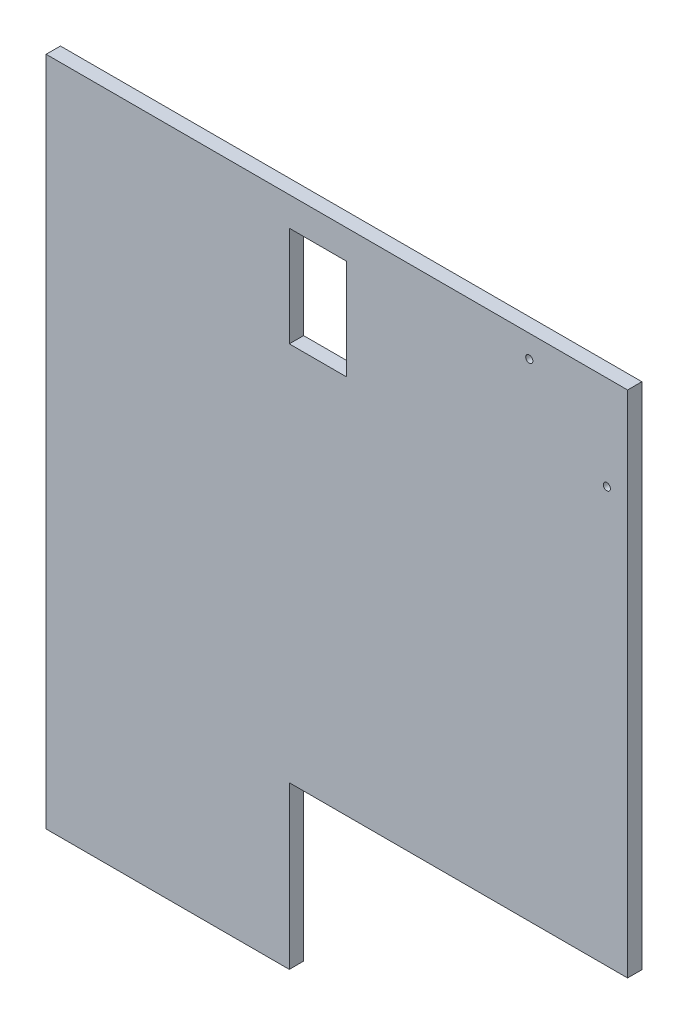
from build123d import *

# Parameters (mm, degrees)
SKETCH_1_R      = 50
SKETCH_1_W      = 800
SKETCH_1_H      = 1400
EXTRUDE_1_DEPTH = 200


with BuildPart() as part:
    # Эскиз1 → Бобышка-Вытянуть1 (new body)
    with BuildSketch(Plane.XY):
        Polygon((0, 0), (8127, 0), (8127, -7118), (3399, -7118), (3399, -9378), (0, -9378), align=None)
        with Locations((7837.410737103, -1315.320353334)):
            Circle(SKETCH_1_R, mode=Mode.SUBTRACT)
        with Locations((6753.169536369, -313.506846223)):
            Circle(SKETCH_1_R, mode=Mode.SUBTRACT)
        with Locations((3799, -1106)):
            Rectangle(SKETCH_1_W, SKETCH_1_H, mode=Mode.SUBTRACT)
    extrude(amount=-EXTRUDE_1_DEPTH)


solid = part.part
